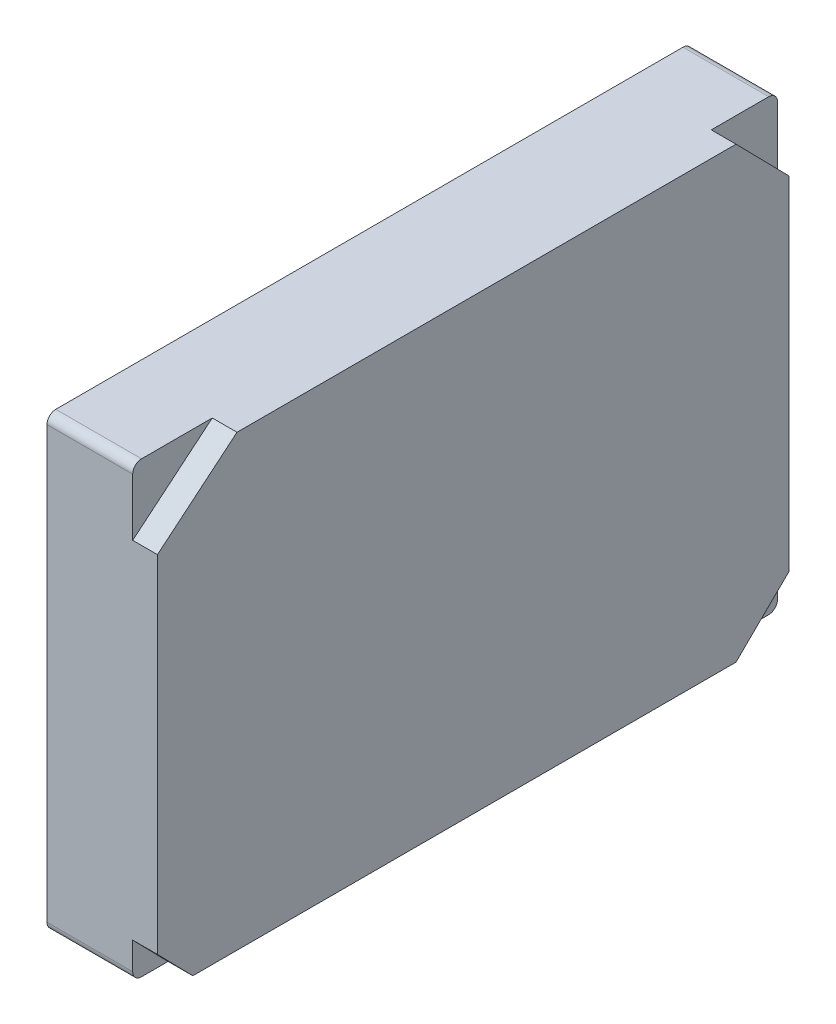
from build123d import *

# Parameters (mm, degrees)
SKETCH1_W           = 145.9
SKETCH1_H           = 101.5
BOSS_EXTRUDE1_DEPTH = 25
CUT_EXTRUDE1_DEPTH  = 5.6
FILLET1_R           = 2
SKETCH3_R           = 1.5
CUT_EXTRUDE2_DEPTH  = 5
SKETCH4_W           = 5.2
SKETCH4_H           = 1.393306894
SKETCH4_H_2         = 0.957581617
CUT_EXTRUDE3_DEPTH  = 3
CUT_EXTRUDE4_DEPTH  = 4


with BuildPart() as part:
    # Sketch1 → Boss-Extrude1 (new body)
    with BuildSketch(Plane(origin=(0, 0, 0), x_dir=(0, 0, -1), z_dir=(1, 0, 0))):
        with Locations((9.359172662, -19.957733813)):
            Rectangle(SKETCH1_W, SKETCH1_H)
    extrude(amount=BOSS_EXTRUDE1_DEPTH)

    # Sketch2 → Cut-Extrude1 (cut)
    with BuildSketch(Plane(origin=(25, 0, 0), x_dir=(0, 0, -1), z_dir=(1, 0, 0))):
        Polygon((67.309172662, 30.792266187), (79.309172662, 18.566731656), (79.309172662, -58.929107722), (67.309172662, -70.707733813), (82.309172662, -70.707733813), (82.309172662, 30.792266187), align=None)
        Polygon((-45.590827338, 30.792266187), (-63.590827338, 15.815954922), (-63.590827338, 30.792266187), align=None)
        Polygon((-63.590827338, -62.51914727), (-55.590827338, -70.707733813), (-63.590827338, -70.707733813), align=None)
    extrude(amount=-CUT_EXTRUDE1_DEPTH, mode=Mode.SUBTRACT)

    # Fillet1
    fillet1_edges = [part.edges().sort_by_distance(p)[0] for p in [
        (9.7, 30.792266187, -82.309172662),
        (9.7, -70.707733813, -82.309172662),
        (9.7, 30.792266187, 63.590827338),
        (9.7, -70.707733813, 63.590827338),
    ]]
    fillet(fillet1_edges, radius=FILLET1_R)

    # Sketch3 → Cut-Extrude2 (cut)
    with BuildSketch(Plane.ZY):
        with Locations((-64.000619116, 27.792266187)):
            Circle(SKETCH3_R)
        with Locations((12.499380884, 27.792266187)):
            Circle(SKETCH3_R)
        with Locations((-64.000619116, -67.707733813)):
            Circle(SKETCH3_R)
        with Locations((12.499380884, -67.707733813)):
            Circle(SKETCH3_R)
    extrude(amount=-CUT_EXTRUDE2_DEPTH, mode=Mode.SUBTRACT)

    # Sketch4 → Cut-Extrude3 (cut)
    with BuildSketch(Plane(origin=(0, 0, -82.309172662), x_dir=(-1, 0, 0), z_dir=(0, 0, -1))):
        with Locations((-4.6, -65.40438726)):
            Rectangle(SKETCH4_W, SKETCH4_H)
        with Locations((-4.6, 25.271056996)):
            Rectangle(SKETCH4_W, SKETCH4_H_2)
    extrude(amount=-CUT_EXTRUDE3_DEPTH, mode=Mode.SUBTRACT)

    # Sketch5 → Cut-Extrude4 (cut)
    with BuildSketch(Plane(origin=(0, 0, -82.309172662), x_dir=(-1, 0, 0), z_dir=(0, 0, -1))):
        Polygon((0, -41.532404589), (-0.8, -41.532404589), (-0.8, -21.907733813), (-4, -21.907733813), (-4, -24.107733813), (-5.4, -24.107733813), (-5.4, -61.107733813), (-0.8, -61.107733813), (-0.8, -63.307733813), (0, -63.307733813), align=None)
    extrude(amount=-CUT_EXTRUDE4_DEPTH, mode=Mode.SUBTRACT)


solid = part.part
